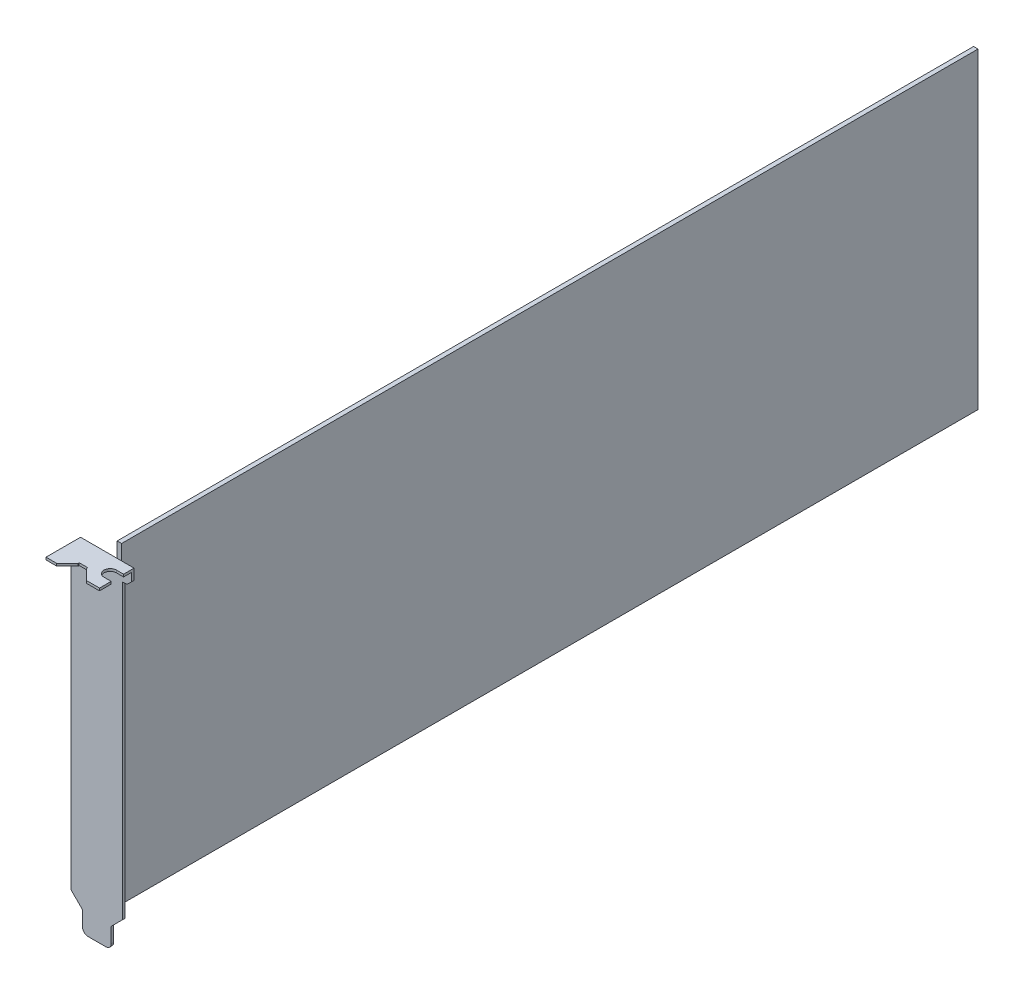
from build123d import *

# Parameters (mm, degrees)
SKETCH1_W           = 1.57
SKETCH1_H           = 111.15
PCB_DEPTH           = 304.8
BOSS_EXTRUDE2_DEPTH = 0.86
CUT_EXTRUDE1_REACH  = 327.615
CUT_EXTRUDE2_REACH  = 327.615
FILLET2_R           = 1.27
FILLET1_R           = 1.91
SKETCH8_W           = 19.05
SKETCH8_H           = 0.86
BOSS_EXTRUDE4_DEPTH = 12.29
CUT_EXTRUDE3_REACH  = 341.707


with BuildPart() as part:
    # Sketch1 → pcb (new body)
    with BuildSketch(Plane.XY):
        with Locations((0.785, 55.575)):
            Rectangle(SKETCH1_W, SKETCH1_H)
    extrude(amount=PCB_DEPTH)

    # mounting-slot → Boss-Extrude2 (add)
    with BuildSketch(Plane.XY.offset(304.8)):
        Polygon((-15.58, 104.91), (2.84, 104.91), (6.01, 104.91), (6.01, 100.35), (2.84, 100.35), (2.84, -3.73), (-1.27, -7.84), (-1.27, -15.11), (-11.46, -15.11), (-11.46, -7.84), (-15.58, -3.72), align=None)
    extrude(amount=BOSS_EXTRUDE2_DEPTH)

    # Sketch5 → Cut-Extrude1 (cut, up to next)
    with BuildSketch(Plane.XY.offset(305.66), mode=Mode.PRIVATE) as cut_extrude1_sk1:
        Polygon((-15.58, 99.29), (-13.04, 101.83), (-13.04, 104.91), (-15.58, 104.91), align=None)
    cut_extrude1_tool1 = extrude(cut_extrude1_sk1.sketch, amount=-CUT_EXTRUDE1_REACH, mode=Mode.PRIVATE) & part.part
    add(cut_extrude1_tool1.solids().sort_by_distance((-14.433594, 102.673203, 305.66))[0], mode=Mode.SUBTRACT)

    # Sketch7 → Cut-Extrude2 (cut, up to next)
    with BuildSketch(Plane.XY.offset(305.66), mode=Mode.PRIVATE) as cut_extrude2_sk1:
        Polygon((6.01, 101.99), (4.37, 100.35), (6.01, 100.35), align=None)
    cut_extrude2_tool1 = extrude(cut_extrude2_sk1.sketch, amount=-CUT_EXTRUDE2_REACH, mode=Mode.PRIVATE) & part.part
    add(cut_extrude2_tool1.solids().sort_by_distance((5.463333, 100.896667, 305.66))[0], mode=Mode.SUBTRACT)

    # Fillet2
    fillet2_edges = [part.edges().sort_by_distance(p)[0] for p in [
        (4.37, 100.35, 305.23),
    ]]
    fillet(fillet2_edges, radius=FILLET2_R)

    # Fillet1
    fillet1_edges = [part.edges().sort_by_distance(p)[0] for p in [
        (-11.46, -15.11, 305.23),
        (-1.27, -15.11, 305.23),
    ]]
    fillet(fillet1_edges, radius=FILLET1_R)

    # Sketch8 → Boss-Extrude4 (add)
    with BuildSketch(Plane(origin=(0, 0, 304.8), x_dir=(-1, 0, 0), z_dir=(0, 0, -1))):
        with Locations((3.515, 105.34)):
            Rectangle(SKETCH8_W, SKETCH8_H)
    extrude(amount=-BOSS_EXTRUDE4_DEPTH)

    # Sketch9 → Cut-Extrude3 (cut, up to next)
    with BuildSketch(Plane(origin=(0, 105.77, 0), x_dir=(1, 0, 0), z_dir=(0, 1, 0)), mode=Mode.PRIVATE) as cut_extrude3_sk1:
        Polygon((-9.23, -317.09), (-5.42, -313.28), (-5.42, -312.9), (-2.37, -312.9), (-2.37, -313.28), (1.44, -317.09), align=None)
    cut_extrude3_tool1 = extrude(cut_extrude3_sk1.sketch, amount=-CUT_EXTRUDE3_REACH, mode=Mode.PRIVATE) & part.part
    # Sketch9 → Cut-Extrude3 (cut, up to next)
    with BuildSketch(Plane(origin=(0, 105.77, 0), x_dir=(1, 0, 0), z_dir=(0, 1, 0)), mode=Mode.PRIVATE) as cut_extrude3_sk2:
        with BuildLine():
            Line((6.01, -308.53), (3.465, -308.53))
            ThreePointArc((3.465, -308.53), (1.255, -310.74), (3.465, -312.95))
            Line((3.465, -312.95), (6.01, -312.95))
            Line((6.01, -312.95), (6.01, -308.53))
        make_face()
    cut_extrude3_tool2 = extrude(cut_extrude3_sk2.sketch, amount=-CUT_EXTRUDE3_REACH, mode=Mode.PRIVATE) & part.part
    add(cut_extrude3_tool1.solids().sort_by_distance((-3.895, 105.77, 315.433744))[0], mode=Mode.SUBTRACT)
    add(cut_extrude3_tool2.solids().sort_by_distance((3.841216, 105.77, 310.74))[0], mode=Mode.SUBTRACT)


solid = part.part
